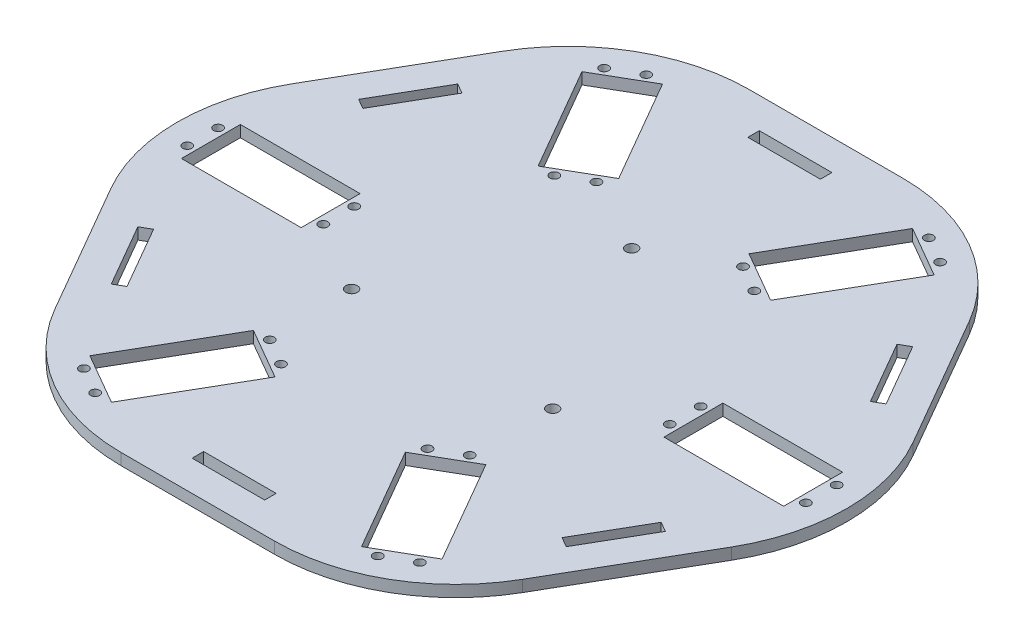
from build123d import *

# Parameters (mm, degrees)
SKETCH1_R           = 2.5
SKETCH1_W           = 40
SKETCH1_H           = 6.35
BOSS_EXTRUDE1_DEPTH = 6.35
SKETCH2_R           = 3.2
CUT_EXTRUDE1_DEPTH  = 6.35


with BuildPart() as part:
    # Sketch1 → Boss-Extrude1 (new body)
    with BuildSketch(Plane(origin=(0, 0, 0), x_dir=(1, 0, 0), z_dir=(0, 1, 0))):
        with BuildLine():
            ThreePointArc((171.132486541, -50), (181.122528791, -25.88190451), (184.529946162, 0))
            ThreePointArc((184.529946162, 0), (181.122528791, 25.88190451), (171.132486541, 50))
            Line((171.132486541, 50), (128.867513459, 123.205080757))
            ThreePointArc((128.867513459, 123.205080757), (92.264973081, 159.807621135), (42.264973081, 173.205080757))
            Line((42.264973081, 173.205080757), (-42.264973081, 173.205080757))
            ThreePointArc((-42.264973081, 173.205080757), (-92.264973081, 159.807621135), (-128.867513459, 123.205080757))
            Line((-128.867513459, 123.205080757), (-171.132486541, 50))
            ThreePointArc((-171.132486541, 50), (-184.529946162, 0), (-171.132486541, -50))
            Line((-171.132486541, -50), (-128.867513459, -123.205080757))
            ThreePointArc((-128.867513459, -123.205080757), (-92.264973081, -159.807621135), (-42.264973081, -173.205080757))
            Line((-42.264973081, -173.205080757), (42.264973081, -173.205080757))
            ThreePointArc((42.264973081, -173.205080757), (92.264973081, -159.807621135), (128.867513459, -123.205080757))
            Line((128.867513459, -123.205080757), (171.132486541, -50))
        make_face()
        with Locations(Location((-92.611215932, -143.407331345, 0), (0, 0, 270))):
            Circle(SKETCH1_R, mode=Mode.SUBTRACT)
        with Locations(Location((-77.888784068, -151.907331345, 0), (0, 0, 270))):
            Circle(SKETCH1_R, mode=Mode.SUBTRACT)
        Polygon((-38.958176102, -92.977540378), (-35.927087189, -94.727540378), (-42.427087189, -105.985870628), (-62.427087189, -140.626886779), (-68.927087189, -151.885217028), (-71.958176102, -150.135217028), (-94.041823898, -137.385217028), (-97.072912811, -135.635217028), (-90.572912811, -124.376886779), (-70.572912811, -89.735870628), (-64.072912811, -78.477540378), (-61.041823898, -80.227540378), align=None, mode=Mode.SUBTRACT)
        with Locations(Location((-40.388784068, -86.955426061, 0), (0, 0, 270))):
            Circle(SKETCH1_R, mode=Mode.SUBTRACT)
        Polygon((-145.403071882, -60.854491924), (-139.903810568, -57.679491924), (-119.903810568, -92.320508076), (-125.403071882, -95.495508076), align=None, mode=Mode.SUBTRACT)
        with Locations(Location((-170.5, -8.5, 0), (0, 0, 270))):
            Circle(SKETCH1_R, mode=Mode.SUBTRACT)
        Polygon((-100, -12.75), (-100, -16.25), (-113, -16.25), (-153, -16.25), (-166, -16.25), (-166, -12.75), (-166, 12.75), (-166, 16.25), (-153, 16.25), (-113, 16.25), (-100, 16.25), (-100, 12.75), align=None, mode=Mode.SUBTRACT)
        with Locations(Location((-95.5, -8.5, 0), (0, 0, 270))):
            Circle(SKETCH1_R, mode=Mode.SUBTRACT)
        with Locations(Location((-55.111215932, -78.455426061, 0), (0, 0, 270))):
            Circle(SKETCH1_R, mode=Mode.SUBTRACT)
        with Locations((0, -153.175)):
            Rectangle(SKETCH1_W, SKETCH1_H, mode=Mode.SUBTRACT)
        with Locations(Location((77.888784068, -151.907331345, 0), (0, 0, 270))):
            Circle(SKETCH1_R, mode=Mode.SUBTRACT)
        with Locations(Location((40.388784068, -86.955426061, 0), (0, 0, 270))):
            Circle(SKETCH1_R, mode=Mode.SUBTRACT)
        Polygon((61.041823898, -80.227540378), (64.072912811, -78.477540378), (70.572912811, -89.735870628), (90.572912811, -124.376886779), (97.072912811, -135.635217028), (94.041823898, -137.385217028), (71.958176102, -150.135217028), (68.927087189, -151.885217028), (62.427087189, -140.626886779), (42.427087189, -105.985870628), (35.927087189, -94.727540378), (38.958176102, -92.977540378), align=None, mode=Mode.SUBTRACT)
        with Locations(Location((92.611215932, -143.407331345, 0), (0, 0, 270))):
            Circle(SKETCH1_R, mode=Mode.SUBTRACT)
        with Locations(Location((55.111215932, -78.455426061, 0), (0, 0, 270))):
            Circle(SKETCH1_R, mode=Mode.SUBTRACT)
        Polygon((125.403071882, -95.495508076), (119.903810568, -92.320508076), (139.903810568, -57.679491924), (145.403071882, -60.854491924), align=None, mode=Mode.SUBTRACT)
        with Locations(Location((95.5, -8.5, 0), (0, 0, 270))):
            Circle(SKETCH1_R, mode=Mode.SUBTRACT)
        with Locations(Location((170.5, -8.5, 0), (0, 0, 270))):
            Circle(SKETCH1_R, mode=Mode.SUBTRACT)
        with Locations(Location((-170.5, 8.5, 0), (0, 0, 270))):
            Circle(SKETCH1_R, mode=Mode.SUBTRACT)
        with Locations(Location((-95.5, 8.5, 0), (0, 0, 270))):
            Circle(SKETCH1_R, mode=Mode.SUBTRACT)
        Polygon((-125.403071882, 95.495508076), (-119.903810568, 92.320508076), (-139.903810568, 57.679491924), (-145.403071882, 60.854491924), align=None, mode=Mode.SUBTRACT)
        with Locations(Location((-55.111215932, 78.455426061, 0), (0, 0, 270))):
            Circle(SKETCH1_R, mode=Mode.SUBTRACT)
        with Locations(Location((-92.611215932, 143.407331345, 0), (0, 0, 270))):
            Circle(SKETCH1_R, mode=Mode.SUBTRACT)
        Polygon((-61.041823898, 80.227540378), (-64.072912811, 78.477540378), (-70.572912811, 89.735870628), (-90.572912811, 124.376886779), (-97.072912811, 135.635217028), (-94.041823898, 137.385217028), (-71.958176102, 150.135217028), (-68.927087189, 151.885217028), (-62.427087189, 140.626886779), (-42.427087189, 105.985870628), (-35.927087189, 94.727540378), (-38.958176102, 92.977540378), align=None, mode=Mode.SUBTRACT)
        with Locations(Location((-40.388784068, 86.955426061, 0), (0, 0, 270))):
            Circle(SKETCH1_R, mode=Mode.SUBTRACT)
        with Locations(Location((-77.888784068, 151.907331345, 0), (0, 0, 270))):
            Circle(SKETCH1_R, mode=Mode.SUBTRACT)
        with Locations(Location((55.111215932, 78.455426061, 0), (0, 0, 270))):
            Circle(SKETCH1_R, mode=Mode.SUBTRACT)
        with Locations(Location((95.5, 8.5, 0), (0, 0, 270))):
            Circle(SKETCH1_R, mode=Mode.SUBTRACT)
        Polygon((100, -12.75), (100, 0), (100, 12.75), (100, 16.25), (113, 16.25), (153, 16.25), (166, 16.25), (166, 12.75), (166, 0), (166, -12.75), (166, -16.25), (153, -16.25), (113, -16.25), (100, -16.25), align=None, mode=Mode.SUBTRACT)
        with Locations(Location((170.5, 8.5, 0), (0, 0, 270))):
            Circle(SKETCH1_R, mode=Mode.SUBTRACT)
        Polygon((145.403071882, 60.854491924), (139.903810568, 57.679491924), (119.903810568, 92.320508076), (125.403071882, 95.495508076), align=None, mode=Mode.SUBTRACT)
        with Locations(Location((40.388784068, 86.955426061, 0), (0, 0, 270))):
            Circle(SKETCH1_R, mode=Mode.SUBTRACT)
        Polygon((38.958176102, 92.977540378), (35.927087189, 94.727540378), (42.427087189, 105.985870628), (62.427087189, 140.626886779), (68.927087189, 151.885217028), (71.958176102, 150.135217028), (94.041823898, 137.385217028), (97.072912811, 135.635217028), (90.572912811, 124.376886779), (70.572912811, 89.735870628), (64.072912811, 78.477540378), (61.041823898, 80.227540378), align=None, mode=Mode.SUBTRACT)
        with Locations((0, 153.175)):
            Rectangle(SKETCH1_W, SKETCH1_H, mode=Mode.SUBTRACT)
        with Locations(Location((77.888784068, 151.907331345, 0), (0, 0, 270))):
            Circle(SKETCH1_R, mode=Mode.SUBTRACT)
        with Locations(Location((92.611215932, 143.407331345, 0), (0, 0, 270))):
            Circle(SKETCH1_R, mode=Mode.SUBTRACT)
    extrude(amount=BOSS_EXTRUDE1_DEPTH)

    # Sketch2 → Cut-Extrude1 (cut)
    with BuildSketch(Plane(origin=(0, 6.35, 0), x_dir=(1, 0, 0), z_dir=(0, 1, 0))):
        with Locations(Location((55.794244464, -33.346698257, 0), (0, 0, 270))):
            Circle(SKETCH2_R)
        with Locations(Location((-56.776210055, -31.645883963, 0), (0, 0, 270))):
            Circle(SKETCH2_R)
        with Locations(Location((0.981965591, 64.99258222, 0), (0, 0, 270))):
            Circle(SKETCH2_R)
    extrude(amount=-CUT_EXTRUDE1_DEPTH, mode=Mode.SUBTRACT)


solid = part.part
